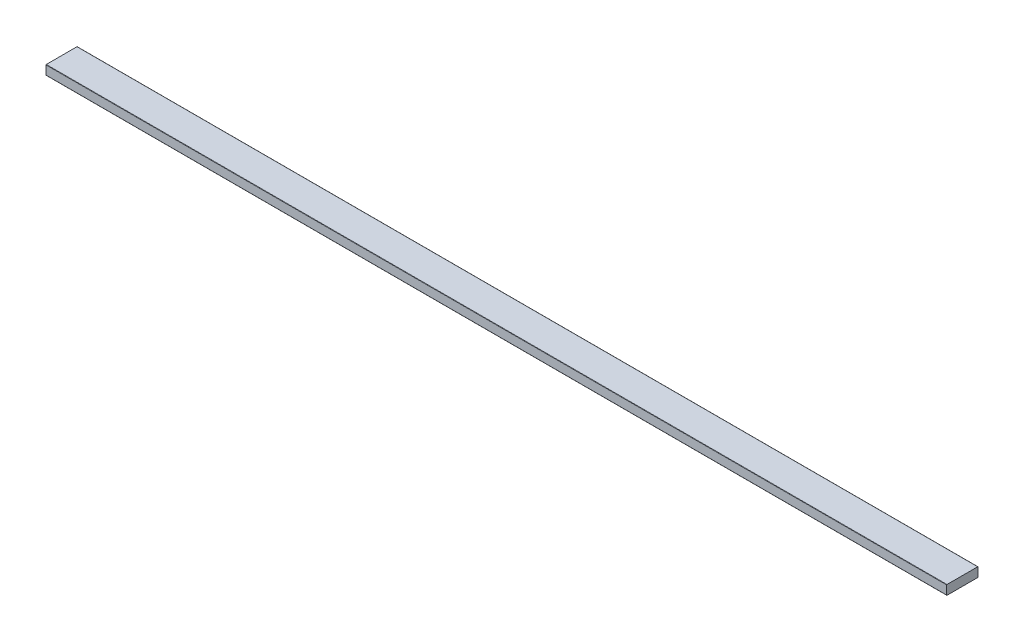
from build123d import *

# Parameters (mm, degrees)
BOSS_EXTRUDE1_DEPTH      = 4.7625
BOSS_EXTRUDE1_DEPTH_BACK = 4.7625
SKETCH3_W                = 914.4
SKETCH3_H                = 31.75
FILLET1_R                = 0.314325


with BuildPart() as part:
    # Sketch3 → Boss-Extrude1 (new, two sides: drawn at the far end of the back side and taken through both)
    with BuildSketch(Plane(origin=(0, 0, 0), x_dir=(1, 0, 0), z_dir=(0, 1, 0)).offset(-BOSS_EXTRUDE1_DEPTH_BACK)):
        Rectangle(SKETCH3_W, SKETCH3_H)
    extrude(amount=BOSS_EXTRUDE1_DEPTH + BOSS_EXTRUDE1_DEPTH_BACK)

    # Fillet1
    fillet1_edges = [part.edges().sort_by_distance(p)[0] for p in [
        (0, 4.7625, 15.875),
        (0, -4.7625, -15.875),
        (0, 4.7625, -15.875),
        (0, -4.7625, 15.875),
    ]]
    fillet(fillet1_edges, radius=FILLET1_R)


solid = part.part
